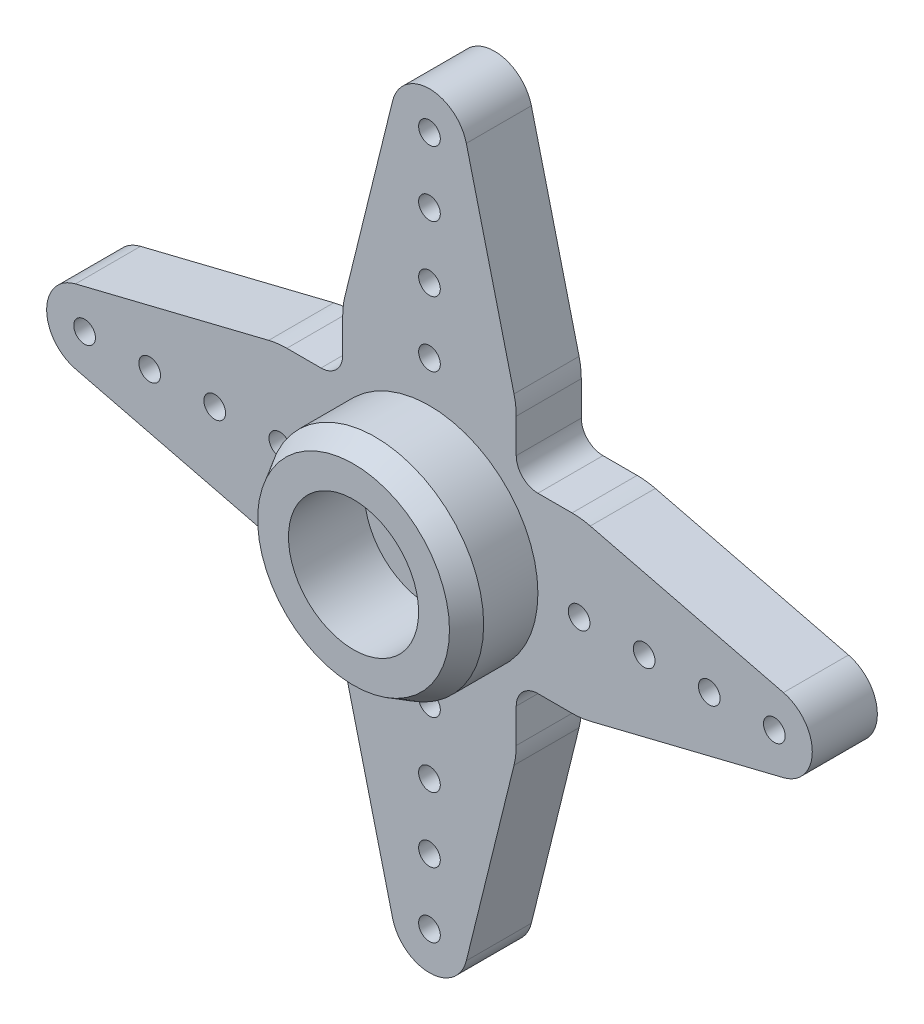
from build123d import *

# Parameters (mm, degrees)
BOSS_EXTRUDE1_DEPTH   = 3
F_1_0MM_DOWEL_HOLE1_D = 1
LPATTERN1_COUNT       = 4
LPATTERN1_PITCH       = 3
CIRPATTERN1_COUNT     = 4
CIRPATTERN1_COPY_1_D  = 1
CIRPATTERN1_COPY_2_D  = 1
CIRPATTERN1_COPY_3_D  = 1
CIRPATTERN1_COPY_4_D  = 1
CIRPATTERN1_COPY_5_D  = 1
CIRPATTERN1_COPY_6_D  = 1
CIRPATTERN1_COPY_7_D  = 1
CIRPATTERN1_COPY_8_D  = 1
CIRPATTERN1_COPY_9_D  = 1
SKETCH6_R             = 5
SKETCH6_R_2           = 3
BOSS_EXTRUDE2_DEPTH   = 3.5
CHAMFER1_SIZE         = 1
CHAMFER1_SIZE2        = 0.577350269
FILLET1_R             = 1


with BuildPart() as part:
    # Sketch1 → Boss-Extrude1 (new body)
    with BuildSketch(Plane.XY):
        with BuildLine():
            Line((-4, 0), (-4, 6.574293681))
            ThreePointArc((-4, 6.574293681), (-3.974394349, 6.996885575), (-3.897952052, 7.413294188))
            Line((-3.897952052, 7.413294188), (-1.698976026, 16.319147094))
            ThreePointArc((-1.698976026, 16.319147094), (0, 17.649646841), (1.698976026, 16.319147094))
            Line((1.698976026, 16.319147094), (3.897952052, 7.413294188))
            ThreePointArc((3.897952052, 7.413294188), (3.974394349, 6.996885575), (4, 6.574293681))
            Line((4, 6.574293681), (4, 0))
            Line((4, 0), (1.25, 0))
            ThreePointArc((1.25, 0), (0, 1.25), (-1.25, 0))
            Line((-1.25, 0), (-4, 0))
        make_face()
    boss_extrude1 = extrude(amount=BOSS_EXTRUDE1_DEPTH)

    # Ø1.0mm Dowel Hole1 (through all)
    with Locations(Plane.XY.offset(3)):
        with Locations((0, 15.899646841)):
            f_1_0mm_dowel_hole1 = Hole(F_1_0MM_DOWEL_HOLE1_D / 2)

    # LPattern1: Ø1.0mm Dowel Hole1 ×4
    with Locations(*[(0, -i * LPATTERN1_PITCH, 0) for i in range(1, LPATTERN1_COUNT)]):
        add(f_1_0mm_dowel_hole1, mode=Mode.SUBTRACT)

    # CirPattern1: Boss-Extrude1, Ø1.0mm Dowel Hole1 ×4 about axis
    cirpattern1_axis = Axis((0, 0, 0), (0, 0, 1))
    add([boss_extrude1.rotate(cirpattern1_axis, i * 360 / CIRPATTERN1_COUNT) for i in range(1, CIRPATTERN1_COUNT)])
    add([f_1_0mm_dowel_hole1.rotate(cirpattern1_axis, i * 360 / CIRPATTERN1_COUNT) for i in range(1, CIRPATTERN1_COUNT)], mode=Mode.SUBTRACT)

    # CirPattern1 copy 1 (through all)
    with Locations(Plane(origin=(3, 0, 3), x_dir=(0, 1, 0), z_dir=(0, 0, 1))):
        with Locations((0, 15.899646841)):
            Hole(CIRPATTERN1_COPY_1_D / 2)

    # CirPattern1 copy 2 (through all)
    with Locations(Plane(origin=(0, 3, 3), x_dir=(-1, 0, 0), z_dir=(0, 0, 1))):
        with Locations((0, 15.899646841)):
            Hole(CIRPATTERN1_COPY_2_D / 2)

    # CirPattern1 copy 3 (through all)
    with Locations(Plane(origin=(-3, 0, 3), x_dir=(0, -1, 0), z_dir=(0, 0, 1))):
        with Locations((0, 15.899646841)):
            Hole(CIRPATTERN1_COPY_3_D / 2)

    # CirPattern1 copy 4 (through all)
    with Locations(Plane(origin=(6, 0, 3), x_dir=(0, 1, 0), z_dir=(0, 0, 1))):
        with Locations((0, 15.899646841)):
            Hole(CIRPATTERN1_COPY_4_D / 2)

    # CirPattern1 copy 5 (through all)
    with Locations(Plane(origin=(0, 6, 3), x_dir=(-1, 0, 0), z_dir=(0, 0, 1))):
        with Locations((0, 15.899646841)):
            Hole(CIRPATTERN1_COPY_5_D / 2)

    # CirPattern1 copy 6 (through all)
    with Locations(Plane(origin=(-6, 0, 3), x_dir=(0, -1, 0), z_dir=(0, 0, 1))):
        with Locations((0, 15.899646841)):
            Hole(CIRPATTERN1_COPY_6_D / 2)

    # CirPattern1 copy 7 (through all)
    with Locations(Plane(origin=(9, 0, 3), x_dir=(0, 1, 0), z_dir=(0, 0, 1))):
        with Locations((0, 15.899646841)):
            Hole(CIRPATTERN1_COPY_7_D / 2)

    # CirPattern1 copy 8 (through all)
    with Locations(Plane(origin=(0, 9, 3), x_dir=(-1, 0, 0), z_dir=(0, 0, 1))):
        with Locations((0, 15.899646841)):
            Hole(CIRPATTERN1_COPY_8_D / 2)

    # CirPattern1 copy 9 (through all)
    with Locations(Plane(origin=(-9, 0, 3), x_dir=(0, -1, 0), z_dir=(0, 0, 1))):
        with Locations((0, 15.899646841)):
            Hole(CIRPATTERN1_COPY_9_D / 2)

    # Sketch6 → Boss-Extrude2 (add)
    with BuildSketch(Plane.XY.offset(3)):
        Circle(SKETCH6_R)
        Circle(SKETCH6_R_2, mode=Mode.SUBTRACT)
    extrude(amount=BOSS_EXTRUDE2_DEPTH)

    # Chamfer1
    chamfer1_edges = [part.edges().sort_by_distance(p)[0] for p in [
        (-5, 0, 6.5),
    ]]
    chamfer1_side = [part.faces().sort_by_distance(p)[0] for p in [
        (-5, 0, 4.75),
    ]]
    chamfer(chamfer1_edges, length=CHAMFER1_SIZE, length2=CHAMFER1_SIZE2, reference=chamfer1_side[0])

    # Fillet1
    fillet1_edges = [part.edges().sort_by_distance(p)[0] for p in [
        (4, 4, 1.5),
        (-4, 4, 1.5),
        (-4, -4, 1.5),
        (4, -4, 1.5),
    ]]
    fillet(fillet1_edges, radius=FILLET1_R)


solid = part.part
